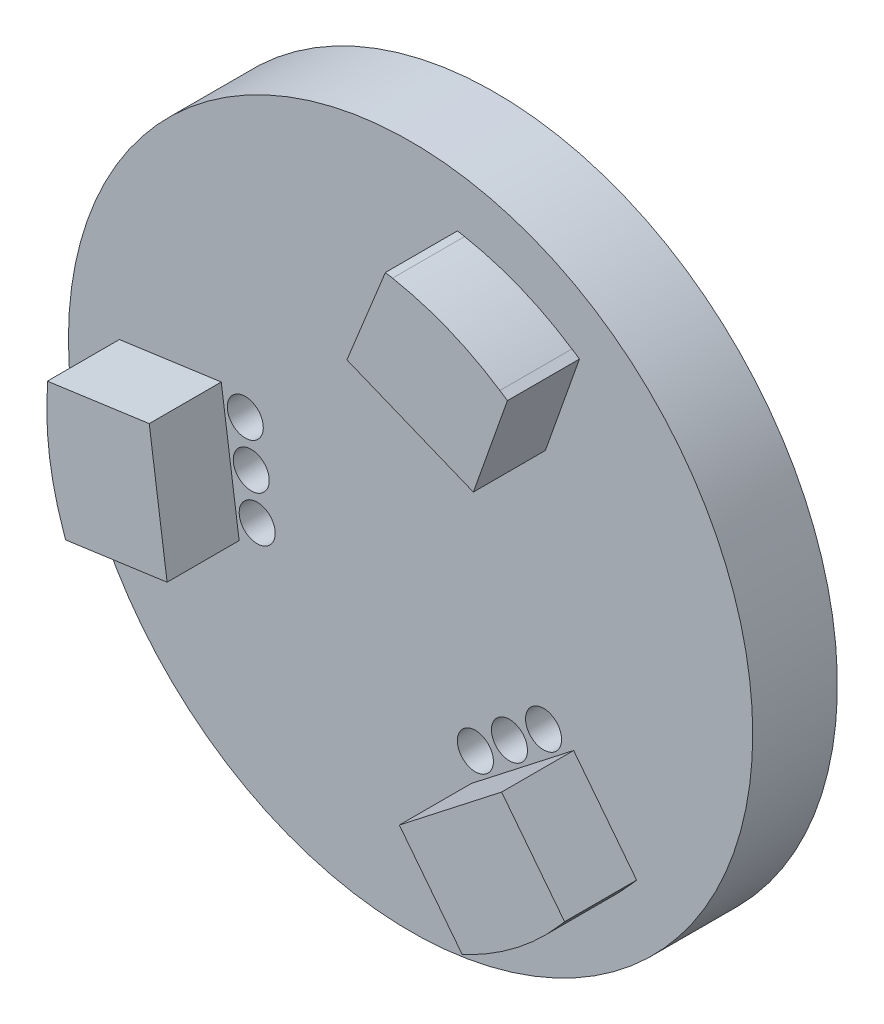
from build123d import *

# Parameters (mm, degrees)
SKETCH2_R           = 9.5
SKETCH2_R_2         = 5.15
BOSS_EXTRUDE1_DEPTH = 3
BOSS_EXTRUDE2_DEPTH = 2
SKETCH4_R           = 5.15
BOSS_EXTRUDE3_DEPTH = 3
SKETCH5_R           = 0.5
CUT_EXTRUDE1_DEPTH  = 14.765899898
SKETCH6_R           = 9.5
CUT_EXTRUDE2_DEPTH  = 0.65


with BuildPart() as part:
    # Sketch2 → Boss-Extrude1 (new body)
    with BuildSketch(Plane.XY):
        Circle(SKETCH2_R)
        Circle(SKETCH2_R_2, mode=Mode.SUBTRACT)
    extrude(amount=BOSS_EXTRUDE1_DEPTH)

    # Sketch3 → Boss-Extrude2 (add)
    with BuildSketch(Plane.XY.offset(3)):
        with BuildLine():
            Line((6.143973875, -5.278407433), (6.275470836, -5.125347271))
            Line((6.275470836, -5.125347271), (4.527710902, -2.882271968))
            Line((4.527710902, -2.882271968), (1.687974032, -5.0949388))
            Line((1.687974032, -5.0949388), (3.435733966, -7.338014103))
            Line((3.435733966, -7.338014103), (3.616296002, -7.247924063))
            ThreePointArc((3.616296002, -7.247924063), (4.978500372, -6.389407957), (6.143973875, -5.278407433))
        make_face()
        with BuildLine():
            Line((-8.085034364, 0.691867379), (-5.256333448, 1.085641007))
            Line((-5.256333448, 1.085641007), (-4.759976196, -2.479976678))
            Line((-4.759976196, -2.479976678), (-7.576416358, -2.872043529))
            Line((-7.576416358, -2.872043529), (-7.643221866, -2.68163374))
            ThreePointArc((-7.643221866, -2.68163374), (-8.022639792, -1.116803816), (-8.085034364, 0.492157827))
            Line((-8.085034364, 0.492157827), (-8.085034364, 0.691867379))
        make_face()
        with BuildLine():
            Line((3.742806644, 3.938550831), (4.68847999, 6.609921942))
            Line((4.68847999, 6.609921942), (4.479502253, 6.748633904))
            ThreePointArc((4.479502253, 6.748633904), (3.050121393, 7.503783012), (1.499247991, 7.960041172))
            Line((1.499247991, 7.960041172), (1.300945522, 7.9973908))
            Line((1.300945522, 7.9973908), (0.232265294, 5.362248647))
            Line((0.232265294, 5.362248647), (3.742806644, 3.938550831))
        make_face()
    extrude(amount=BOSS_EXTRUDE2_DEPTH)

    # Sketch4 → Boss-Extrude3 (add)
    with BuildSketch(Plane(origin=(0, 0, 0), x_dir=(-1, 0, 0), z_dir=(0, 0, -1))):
        Circle(SKETCH4_R)
    extrude(amount=-BOSS_EXTRUDE3_DEPTH)

    # Sketch5 → Cut-Extrude1 (cut, through all)
    with BuildSketch(Plane.XY.offset(3)):
        with Locations((2.745365917, -3.523402937)):
            Circle(SKETCH5_R)
        with Locations((1.79878696, -4.260958548)):
            Circle(SKETCH5_R)
        with Locations(Location((3.691944873, -2.785847327, 0), (0, 0, 180))):
            Circle(SKETCH5_R)
        with Locations(Location((0.566642119, 4.590241713, 0), (0, 0, 180))):
            Circle(SKETCH5_R)
        with Locations(Location((1.678673493, 4.139258095, 0), (0, 0, 180))):
            Circle(SKETCH5_R)
        with Locations((2.790704867, 3.688274478)):
            Circle(SKETCH5_R)
        with Locations(Location((-4.258586993, -1.804394387, 0), (0, 0, 180))):
            Circle(SKETCH5_R)
        with Locations(Location((-4.42403941, -0.615855158, 0), (0, 0, 180))):
            Circle(SKETCH5_R)
        with Locations((-4.589491827, 0.57268407)):
            Circle(SKETCH5_R)
    extrude(amount=-CUT_EXTRUDE1_DEPTH, mode=Mode.SUBTRACT)

    # Sketch6 → Cut-Extrude2 (cut)
    with BuildSketch(Plane(origin=(0, 0, 0), x_dir=(-1, 0, 0), z_dir=(0, 0, -1))):
        Circle(SKETCH6_R)
    extrude(amount=-CUT_EXTRUDE2_DEPTH, mode=Mode.SUBTRACT)


solid = part.part
